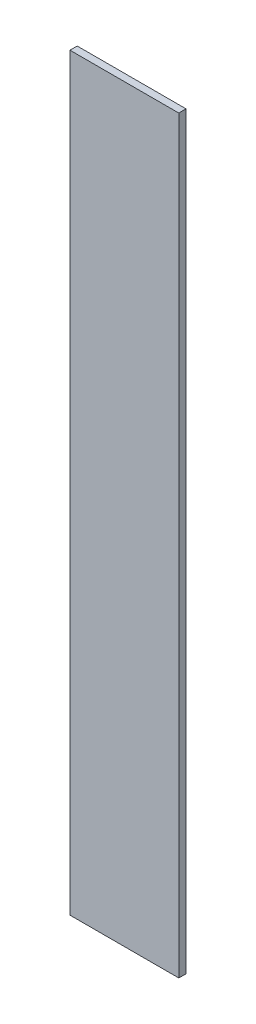
from build123d import *

# Parameters (mm, degrees)
SKETCH1_W           = 3
SKETCH1_H           = 20.65
BOSS_EXTRUDE1_DEPTH = 0.2


with BuildPart() as part:
    # Sketch1 → Boss-Extrude1 (new body)
    with BuildSketch(Plane.XY):
        with Locations((1.5, 10.325)):
            Rectangle(SKETCH1_W, SKETCH1_H)
    extrude(amount=BOSS_EXTRUDE1_DEPTH)


solid = part.part
